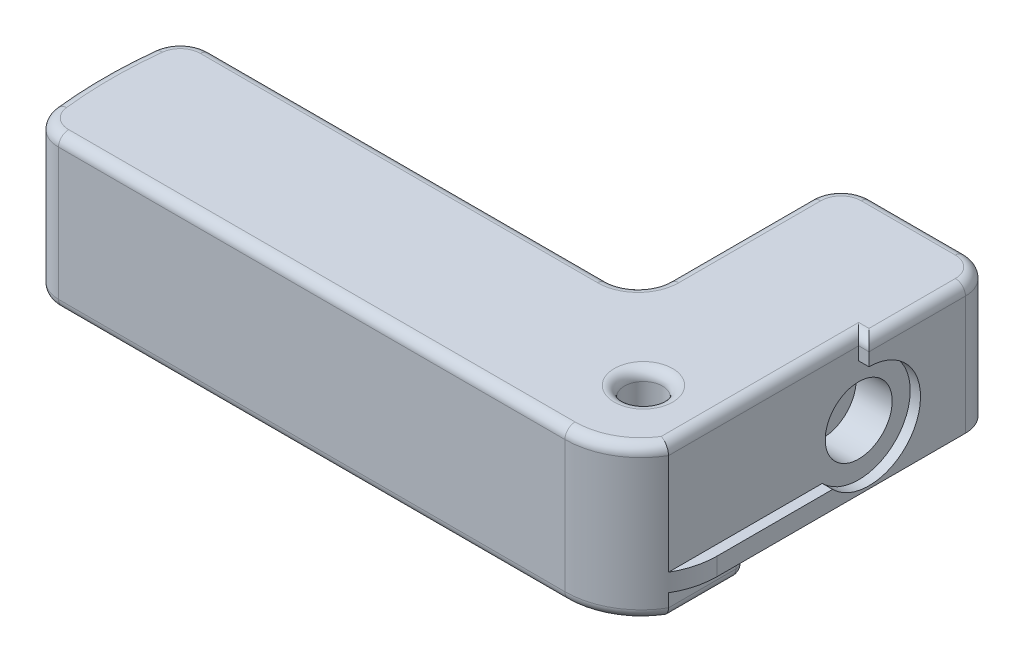
from build123d import *

# Parameters (mm, degrees)
SKETCH1_R           = 1.875
BOSS_EXTRUDE1_DEPTH = 15
SKETCH2_W           = 35
SKETCH2_H           = 2.286
CUT_EXTRUDE1_DEPTH  = 1.778
SKETCH7_W           = 23.625
SKETCH7_H           = 2.286
CUT_EXTRUDE6_DEPTH  = 5
SKETCH3_R           = 3.302
CUT_EXTRUDE2_DEPTH  = 3.556
SKETCH4_R           = 3.302
CUT_EXTRUDE3_DEPTH  = 3.302
SKETCH5_W           = 35
SKETCH5_H           = 15
CUT_EXTRUDE4_DEPTH  = 0.762
CUT_EXTRUDE5_DEPTH  = 73.293856534
FILLET1_R           = 3
FILLET2_R           = 1


with BuildPart() as part:
    # Sketch1 → Boss-Extrude1 (new body)
    with BuildSketch(Plane(origin=(0, 0, 0), x_dir=(1, 0, 0), z_dir=(0, 1, 0))):
        with BuildLine():
            Line((-60.8, 0), (0, 0))
            Line((0, 0), (0, 35))
            Line((0, 35), (-16.036868781, 35))
            Line((-16.036868781, 35), (-16.036868781, 15))
            Line((-16.036868781, 15), (-60.8, 15))
            ThreePointArc((-60.8, 15), (-61.45243439, 7.5), (-60.8, 0))
        make_face()
        with Locations(Location((-8.01843439, 7.5, 0), (0, 0, 270))):
            Circle(SKETCH1_R, mode=Mode.SUBTRACT)
    extrude(amount=BOSS_EXTRUDE1_DEPTH)

    # Sketch2 → Cut-Extrude1 (cut)
    with BuildSketch(Plane(origin=(0, 0, 0), x_dir=(0, 0, -1), z_dir=(1, 0, 0))):
        with BuildLine():
            Line((22.486, 12.716), (22.486, 15))
            Line((22.486, 15), (0, 15))
            Line((0, 15), (0, 4.043897552))
            Line((0, 4.043897552), (18.893897552, 4.043897552))
            ThreePointArc((18.893897552, 4.043897552), (27.179308025, 5.691968164), (22.486, 12.716))
        make_face()
        with Locations((17.5, 1.143)):
            Rectangle(SKETCH2_W, SKETCH2_H)
    extrude(amount=-CUT_EXTRUDE1_DEPTH, mode=Mode.SUBTRACT)

    # Sketch7 → Cut-Extrude6 (cut)
    with BuildSketch(Plane(origin=(-1.778, 0, 0), x_dir=(0, 0, -1), z_dir=(1, 0, 0))):
        with Locations((23.1875, 1.143)):
            Rectangle(SKETCH7_W, SKETCH7_H)
    extrude(amount=-CUT_EXTRUDE6_DEPTH, mode=Mode.SUBTRACT)

    # Sketch3 → Cut-Extrude2 (cut)
    with BuildSketch(Plane(origin=(-1.778, 0, 0), x_dir=(0, 0, -1), z_dir=(1, 0, 0))):
        with Locations((22.486, 7.636)):
            Circle(SKETCH3_R)
    extrude(amount=-CUT_EXTRUDE2_DEPTH, mode=Mode.SUBTRACT)

    # Sketch4 → Cut-Extrude3 (cut)
    with BuildSketch(Plane(origin=(0, 0, -15), x_dir=(-1, 0, 0), z_dir=(0, 0, -1))):
        with Locations((43.57843439, 7.5)):
            Circle(SKETCH4_R)
    extrude(amount=-CUT_EXTRUDE3_DEPTH, mode=Mode.SUBTRACT)

    # Sketch5 → Cut-Extrude4 (cut)
    with BuildSketch(Plane(origin=(0, 0, 0), x_dir=(0, 0, -1), z_dir=(1, 0, 0))):
        with Locations((17.5, 7.5)):
            Rectangle(SKETCH5_W, SKETCH5_H)
    extrude(amount=-CUT_EXTRUDE4_DEPTH, mode=Mode.SUBTRACT)

    # Sketch6 → Cut-Extrude5 (cut, through all)
    with BuildSketch(Plane(origin=(0, 15, 0), x_dir=(1, 0, 0), z_dir=(0, 1, 0))):
        with BuildLine():
            Line((-8.262, 0), (-0.762, 0))
            Line((-0.762, 0), (-0.762, 7.5))
            ThreePointArc((-0.762, 7.5), (-2.958699141, 2.196699141), (-8.262, 0))
        make_face()
    extrude(amount=-CUT_EXTRUDE5_DEPTH, mode=Mode.SUBTRACT)

    # Fillet1
    fillet1_edges = [part.edges().sort_by_distance(p)[0] for p in [
        (-60.8, 7.5, 0),
        (-60.8, 7.5, -15),
        (-16.036868781, 7.5, -15),
        (-16.036868781, 7.5, -35),
        (-0.762, 8.643, -35),
    ]]
    fillet(fillet1_edges, radius=FILLET1_R)

    # Fillet2
    fillet2_edges = [part.edges().sort_by_distance(p)[0] for p in [
        (-1.778, 0, -7.552841941),
        (-4.521670528, 15, -0.99923578),
        (-4.521670528, 0, -0.99923578),
        (-61.45243439, 0, -7.5),
        (-61.45243439, 15, -7.5),
        (-33.231623045, 0, 0),
        (-38.619057435, 0, -15),
        (-16.036868781, 0, -25),
        (-15.158189125, 0, -34.121320344),
        (-60.201042042, 0, -0.763749534),
        (-60.201042042, 0, -14.236250466),
        (-38.619057435, 15, -15),
        (-0.762, 15, -27.243),
        (-8.39943439, 15, -35),
        (-16.036868781, 15, -25),
        (-33.231623045, 15, 0),
        (-15.158189125, 15, -34.121320344),
        (-1.640679656, 15, -34.121320344),
        (-60.201042042, 15, -0.763749534),
        (-60.201042042, 15, -14.236250466),
        (-16.915548437, 0, -15.878679656),
        (-16.915548437, 15, -15.878679656),
        (-8.01843439, 0, -9.375),
        (-8.01843439, 15, -9.375),
        (-1.778, 15, -13.108341941),
        (-1.27, 15, -22.486),
        (-9.90743439, 0, -35),
        (-4.278, 0, -11.375),
        (-6.778, 0, -23.1875),
        (-1.778, 1.143, -11.375),
    ]]
    fillet(fillet2_edges, radius=FILLET2_R)


solid = part.part
